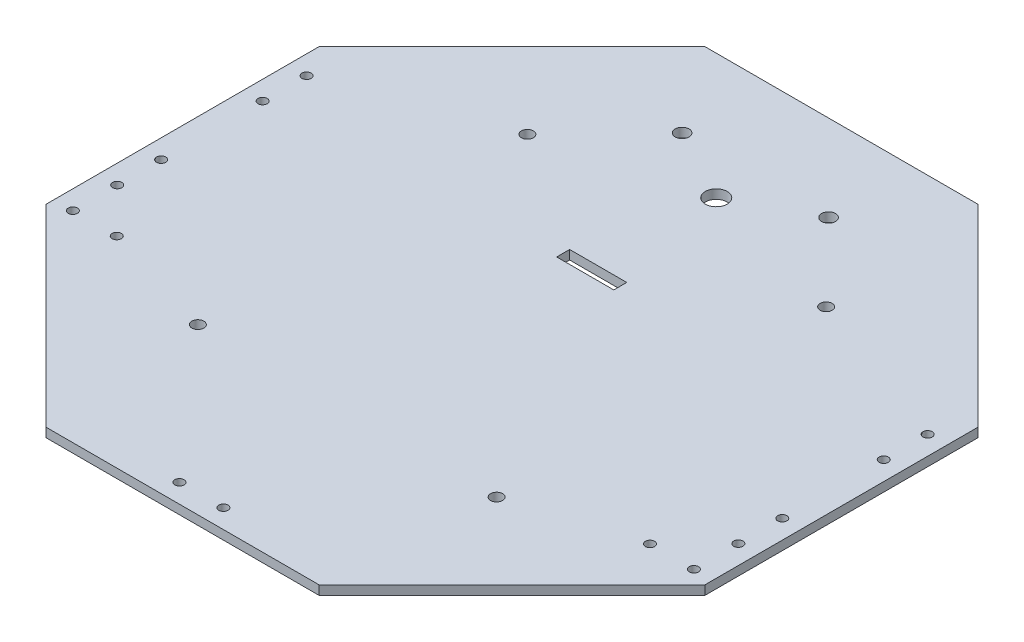
from build123d import *

# Parameters (mm, degrees)
SKETCH1_R            = 2.0828
BOSS_EXTRUDE1_DEPTH  = 3.175
M3_CLEARANCE_HOLE1_D = 3.2
SKETCH5_W            = 19.8
SKETCH5_H            = 4.5
CUT_EXTRUDE1_DEPTH   = 265.974627323
SKETCH7_R            = 2.413
CUT_EXTRUDE2_DEPTH   = 265.974627323
SKETCH8_R            = 3.81
CUT_EXTRUDE3_DEPTH   = 265.974627323


with BuildPart() as part:
    # Sketch1 → Boss-Extrude1 (new body)
    with BuildSketch(Plane(origin=(0, 0, 0), x_dir=(1, 0, 0), z_dir=(0, 1, 0))):
        Polygon((28.855389821, 184.15), (123.544610179, 184.15), (176.5, 131.194610179), (182.5, 125.194610179), (190.5, 117.194610179), (190.5, 22.505389821), (182.5, 14.505389821), (176.5, 8.505389821), (137.544610179, -30.45), (131.544610179, -36.45), (123.544610179, -44.45), (28.855389821, -44.45), (20.855389821, -36.45), (14.855389821, -30.45), (-24.1, 8.505389821), (-30.1, 14.505389821), (-38.1, 22.505389821), (-38.1, 117.194610179), (-30.1, 125.194610179), (-24.1, 131.194610179), align=None)
        with Locations(Location((24.384, 12.7, 0), (0, 0, 270))):
            Circle(SKETCH1_R, mode=Mode.SUBTRACT)
        with Locations(Location((128.016, 12.7, 0), (0, 0, 90))):
            Circle(SKETCH1_R, mode=Mode.SUBTRACT)
        with Locations(Location((128.016, 127, 0), (0, 0, 270))):
            Circle(SKETCH1_R, mode=Mode.SUBTRACT)
        with Locations(Location((24.384, 127, 0), (0, 0, 90))):
            Circle(SKETCH1_R, mode=Mode.SUBTRACT)
    extrude(amount=BOSS_EXTRUDE1_DEPTH)

    # M3 Clearance Hole1 (through all)
    with Locations(Plane(origin=(0, 3.175, 0), x_dir=(1, 0, 0), z_dir=(0, 1, 0))):
        with Locations((-31.5214, 106.313101446), (-31.5214, 91.073101446), (-31.5214, 55.8795536), (-31.5214, 40.6395536), (-31.5214, 25.230335162), (-16.2814, 25.230335162), (68.58, -37.8714), (83.82, -37.8714), (183.9214, 25.230335162), (168.6814, 25.230335162), (183.9214, 40.6395536), (183.9214, 55.8795536), (183.9214, 91.073101446), (183.9214, 106.313101446)):
            Hole(M3_CLEARANCE_HOLE1_D / 2)

    # Sketch5 → Cut-Extrude1 (cut, through all)
    with BuildSketch(Plane(origin=(0, 3.175, 0), x_dir=(1, 0, 0), z_dir=(0, 1, 0))):
        with Locations((76.2, 97.5)):
            Rectangle(SKETCH5_W, SKETCH5_H)
    extrude(amount=-CUT_EXTRUDE1_DEPTH, mode=Mode.SUBTRACT)

    # Sketch7 → Cut-Extrude2 (cut, through all)
    with BuildSketch(Plane(origin=(0, 3.175, 0), x_dir=(1, 0, 0), z_dir=(0, 1, 0))):
        with Locations(Location((50.8, 154.263560488, 0), (0, 0, 270))):
            Circle(SKETCH7_R)
        with Locations(Location((101.6, 154.263560488, 0), (0, 0, 90))):
            Circle(SKETCH7_R)
    extrude(amount=-CUT_EXTRUDE2_DEPTH, mode=Mode.SUBTRACT)

    # Sketch8 → Cut-Extrude3 (cut, through all)
    with BuildSketch(Plane(origin=(0, 3.175, 0), x_dir=(1, 0, 0), z_dir=(0, 1, 0))):
        with Locations(Location((76.2, 140.698010266, 0), (0, 0, 270))):
            Circle(SKETCH8_R)
    extrude(amount=-CUT_EXTRUDE3_DEPTH, mode=Mode.SUBTRACT)


solid = part.part
